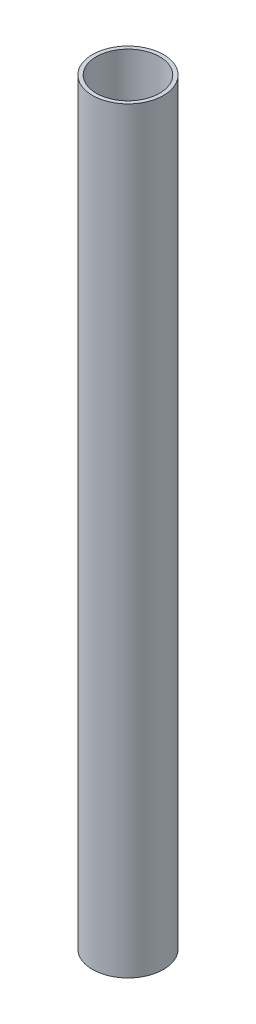
from build123d import *

# Parameters (mm, degrees)
SKETCH1_R           = 37.5
SKETCH1_R_2         = 33.5
BOSS_EXTRUDE1_DEPTH = 800


with BuildPart() as part:
    # Sketch1 → Boss-Extrude1 (new body)
    with BuildSketch(Plane(origin=(0, 0, 0), x_dir=(1, 0, 0), z_dir=(0, 1, 0))):
        with Locations(Location((0, 0, 0), (0, 0, 270))):
            Circle(SKETCH1_R)
        with Locations(Location((0, 0, 0), (0, 0, 270))):
            Circle(SKETCH1_R_2, mode=Mode.SUBTRACT)
    extrude(amount=BOSS_EXTRUDE1_DEPTH)

    # Sketch2 → Revolve1 (revolve)
    with BuildSketch(Plane(origin=(0, 0, 0), x_dir=(0, 0, -1), z_dir=(1, 0, 0)), mode=Mode.PRIVATE) as revolve1_sk:
        Polygon((-33.5, 650), (-30.5, 660), (-33.5, 660), align=None)
    revolve(revolve1_sk.sketch.rotate(Axis((0, 800, 0), (0, -1, 0)), 180), axis=Axis((0, 800, 0), (0, -1, 0)))


solid = part.part
